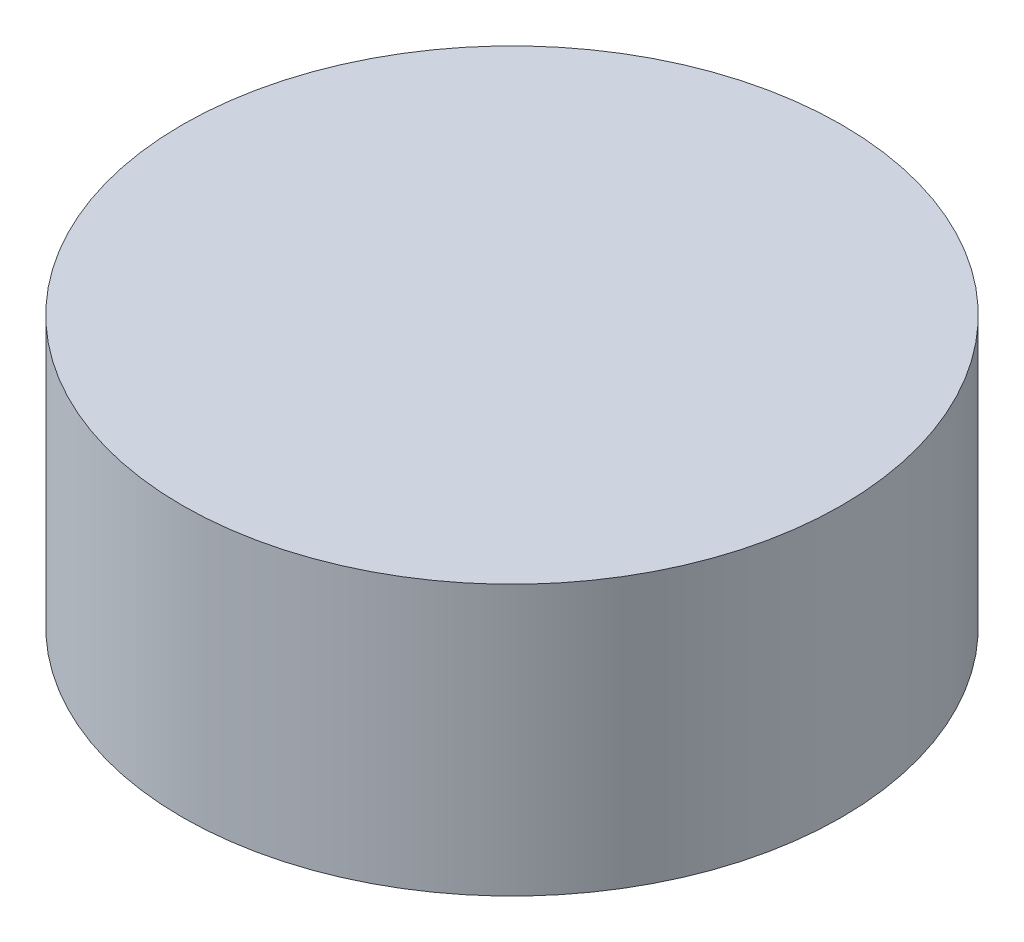
from build123d import *

# Parameters (mm, degrees)
SKETCH4_W = 4.883435582
SKETCH4_H = 4


with BuildPart() as part:
    # Sketch4 → Revolve1 (revolve)
    with BuildSketch(Plane.XY, mode=Mode.PRIVATE) as revolve1_sk:
        with Locations((5.616054949, -0.030678949)):
            Rectangle(SKETCH4_W, SKETCH4_H)
    revolve(revolve1_sk.sketch.rotate(Axis((3.174337158, 1.969321051, 0), (0, -1, 0)), 180), axis=Axis((3.174337158, 1.969321051, 0), (0, -1, 0)))


solid = part.part
